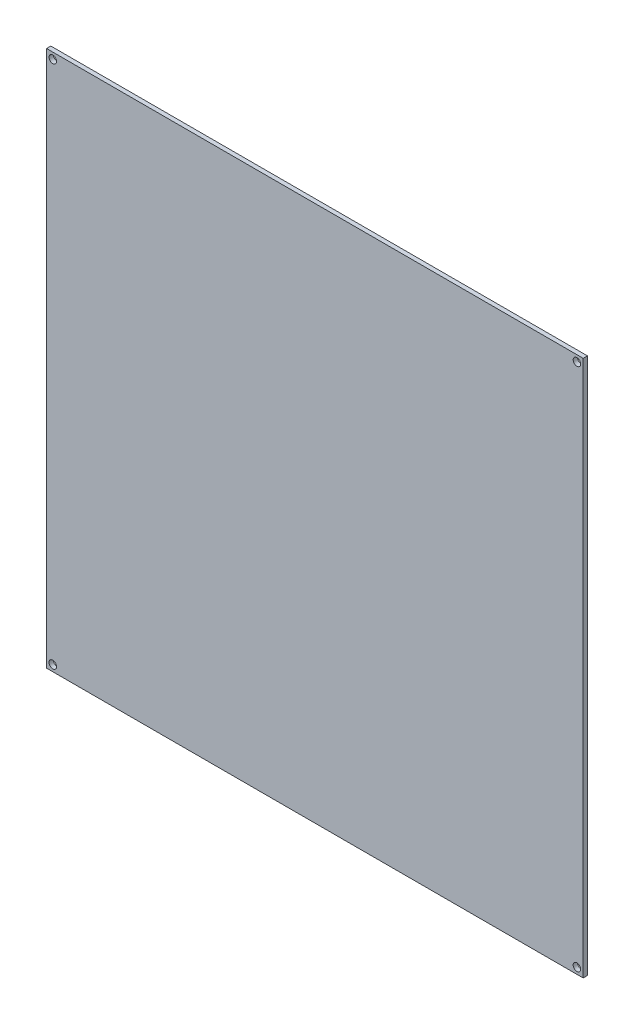
from build123d import *

# Parameters (mm, degrees)
SCHIZZO2_W                   = 214
SCHIZZO2_H                   = 214
SCHIZZO2_R                   = 1.5
ESTRUSIONE_ESTRUSIONE2_DEPTH = 1.7


with BuildPart() as part:
    # Schizzo2 → Estrusione-Estrusione2 (new body)
    with BuildSketch(Plane.XY):
        with Locations((107, 107)):
            Rectangle(SCHIZZO2_W, SCHIZZO2_H)
        with Locations((2.5, 211.5)):
            Circle(SCHIZZO2_R, mode=Mode.SUBTRACT)
        with Locations(Location((211.5, 211.5, 0), (0, 0, 180))):
            Circle(SCHIZZO2_R, mode=Mode.SUBTRACT)
        with Locations((211.5, 2.5)):
            Circle(SCHIZZO2_R, mode=Mode.SUBTRACT)
        with Locations(Location((2.5, 2.5, 0), (0, 0, 180))):
            Circle(SCHIZZO2_R, mode=Mode.SUBTRACT)
    extrude(amount=-ESTRUSIONE_ESTRUSIONE2_DEPTH)


solid = part.part
